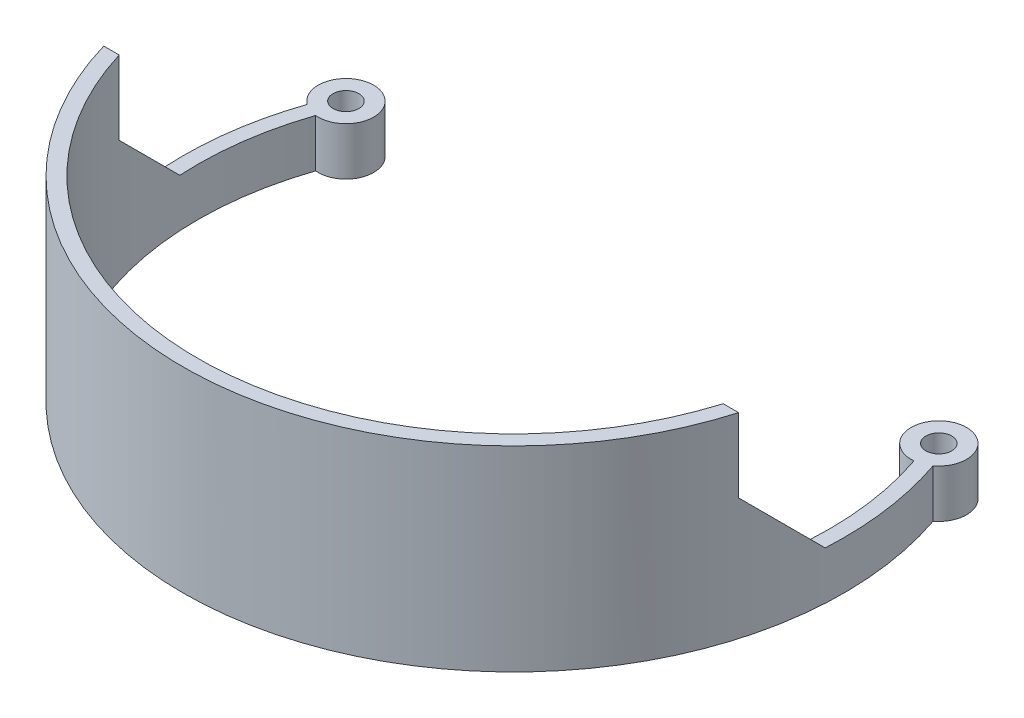
from build123d import *

# Parameters (mm, degrees)
SKETCH_1_R      = 2.2499999999999964
SKETCH_1_R_2    = 3.5000000000000075
EXTRUDE_3_DEPTH = 3
EXTRUDE_START   = 3
SKETCH_1_9_R    = 3.5000000000000075
EXTRUDE_4_DEPTH = 10
EXTRUDE_START_2 = 13
EXTRUDE_5_DEPTH = 40
CHAMFER_1_SIZE  = 20


with BuildPart() as part:
    # 草图1 → 凸台-拉伸3 (new body)
    # profile 1 of 5: a face of its own
    with BuildSketch(Plane(origin=(0, 0, 0), x_dir=(1, 0, 0), z_dir=(0, 1, 0))):
        with BuildLine():
            Line((81.76337811025178, -25), (85.93747727272425, -25))
            ThreePointArc((85.93747727272427, -25.00000000000003), (89.47720115518152, 2.0200181769446033), (84.72170874814934, 28.85276532316719))
            ThreePointArc((84.72170874814934, 28.852765323167215), (77.54750127881047, 41.87005748540227), (80.9872265222124, 27.41020138999083))
            ThreePointArc((80.98722652221241, 27.41020138999082), (85.49062597438983, 1.266045223118958), (81.76337811025176, -25.00000000000003))
        make_face()
        with BuildLine():
            ThreePointArc((79.50393531376338, 31.454320365013906), (78.90792202113376, 38.10634440334943), (83.19867820645547, 32.988330432119156))
            ThreePointArc((83.19867820645547, 32.988330432119156), (82.49378450242521, 32.18772445937683), (81.58047617746915, 31.636622870612896))
            ThreePointArc((81.58047617746915, 31.636622870612896), (80.55609271252037, 31.387290279852397), (79.50393531376338, 31.454320365013903))
        make_face(mode=Mode.SUBTRACT)
    # profile 2 of 5: a face of its own
    with BuildSketch(Plane(origin=(0, 0, 0), x_dir=(1, 0, 0), z_dir=(0, 1, 0))):
        with BuildLine():
            ThreePointArc((83.19867820645547, 32.988330432119156), (78.90792202113373, 38.10634440334942), (79.50393531376338, 31.454320365013903))
            ThreePointArc((79.50393531376338, 31.454320365013903), (80.55609271252037, 31.387290279852397), (81.58047617746915, 31.636622870612896))
            ThreePointArc((81.58047617746915, 31.636622870612896), (82.49378450242521, 32.18772445937683), (83.19867820645547, 32.988330432119156))
        make_face()
        with Locations(Location((80.25, 34.873879910328284, 0), (0, 0, 270))):
            Circle(SKETCH_1_R, mode=Mode.SUBTRACT)
    # profile 3 of 5: a face of its own
    with BuildSketch(Plane(origin=(0, 0, 0), x_dir=(1, 0, 0), z_dir=(0, 1, 0))):
        with BuildLine():
            ThreePointArc((-84.72170874814935, 28.85276532316715), (-89.4772011551815, 2.020018176944596), (-85.93747727272427, -25.00000000000001))
            Line((-85.93747727272425, -25), (-81.76337811025178, -25))
            ThreePointArc((-81.76337811025176, -25.000000000000007), (-85.49062597438983, 1.2660452231190007), (-80.98722652221241, 27.41020138999083))
            ThreePointArc((-80.98722652221241, 27.41020138999083), (-77.54750127881069, 41.87005748540241), (-84.72170874814934, 28.852765323167137))
        make_face()
        with Locations((-80.25, 34.873879910328284)):
            Circle(SKETCH_1_R_2, mode=Mode.SUBTRACT)
    # profile 4 of 5: a face of its own
    with BuildSketch(Plane(origin=(0, 0, 0), x_dir=(1, 0, 0), z_dir=(0, 1, 0))):
        with Locations((-80.25, 34.873879910328284)):
            Circle(SKETCH_1_R_2)
        with Locations(Location((-80.25, 34.873879910328284, 0), (0, 0, 270))):
            Circle(SKETCH_1_R, mode=Mode.SUBTRACT)
    # profile 5 of 5: a face of its own
    with BuildSketch(Plane(origin=(0, 0, 0), x_dir=(1, 0, 0), z_dir=(0, 1, 0))):
        with BuildLine():
            Line((-81.76337811025178, -25), (-85.93747727272425, -25))
            ThreePointArc((-85.93747727272427, -25.00000000000001), (3.55e-15, -89.5), (85.93747727272427, -25.00000000000003))
            Line((85.93747727272425, -25), (81.76337811025178, -25))
            ThreePointArc((81.76337811025176, -25.00000000000003), (-3.55e-15, -85.5), (-81.76337811025176, -25.000000000000007))
        make_face()
    extrude(amount=EXTRUDE_3_DEPTH)

    # 草图1<9> → 凸台-拉伸4 (add)
    # profile 1 of 3: a face of its own
    with BuildSketch(Plane(origin=(0, 0, 0), x_dir=(1, 0, 0), z_dir=(0, 1, 0)).offset(EXTRUDE_START)):
        with BuildLine():
            ThreePointArc((-84.72170874814935, 28.85276532316715), (-89.4772011551815, 2.020018176944596), (-85.93747727272427, -25.00000000000001))
            Line((-85.93747727272425, -25), (-81.76337811025178, -25))
            ThreePointArc((-81.76337811025176, -25.000000000000007), (-85.49062597438983, 1.2660452231190007), (-80.98722652221241, 27.41020138999083))
            ThreePointArc((-80.98722652221241, 27.41020138999083), (-77.54750127881069, 41.87005748540241), (-84.72170874814934, 28.852765323167137))
        make_face()
        with Locations(Location((-80.25, 34.873879910328284, 0), (0, 0, 270))):
            Circle(SKETCH_1_9_R, mode=Mode.SUBTRACT)
    # profile 2 of 3: a face of its own
    with BuildSketch(Plane(origin=(0, 0, 0), x_dir=(1, 0, 0), z_dir=(0, 1, 0)).offset(EXTRUDE_START)):
        with BuildLine():
            Line((-81.76337811025178, -25), (-85.93747727272425, -25))
            ThreePointArc((-85.93747727272427, -25.00000000000001), (3.55e-15, -89.5), (85.93747727272427, -25.00000000000003))
            Line((85.93747727272425, -25), (81.76337811025178, -25))
            ThreePointArc((81.76337811025176, -25.00000000000003), (-3.55e-15, -85.5), (-81.76337811025176, -25.000000000000007))
        make_face()
    # profile 3 of 3: a face of its own
    with BuildSketch(Plane(origin=(0, 0, 0), x_dir=(1, 0, 0), z_dir=(0, 1, 0)).offset(EXTRUDE_START)):
        with BuildLine():
            Line((81.76337811025178, -25), (85.93747727272425, -25))
            ThreePointArc((85.93747727272427, -25.00000000000003), (89.47720115518152, 2.0200181769446033), (84.72170874814934, 28.85276532316719))
            ThreePointArc((84.72170874814934, 28.852765323167215), (77.54750127881047, 41.87005748540227), (80.9872265222124, 27.41020138999083))
            ThreePointArc((80.98722652221241, 27.41020138999082), (85.49062597438983, 1.266045223118958), (81.76337811025176, -25.00000000000003))
        make_face()
        with BuildLine():
            ThreePointArc((79.50393531376338, 31.454320365013906), (78.90792202113376, 38.10634440334943), (83.19867820645547, 32.988330432119156))
            ThreePointArc((83.19867820645547, 32.988330432119156), (82.49378450242521, 32.18772445937683), (81.58047617746915, 31.636622870612896))
            ThreePointArc((81.58047617746915, 31.636622870612896), (80.55609271252037, 31.387290279852397), (79.50393531376338, 31.454320365013903))
        make_face(mode=Mode.SUBTRACT)
    extrude(amount=EXTRUDE_4_DEPTH)

    # 草图1<10> → 凸台-拉伸5 (add)
    with BuildSketch(Plane(origin=(0, 0, 0), x_dir=(1, 0, 0), z_dir=(0, 1, 0)).offset(EXTRUDE_START_2)):
        with BuildLine():
            Line((-81.76337811025178, -25), (-85.93747727272425, -25))
            ThreePointArc((-85.93747727272427, -25.00000000000001), (3.55e-15, -89.5), (85.93747727272427, -25.00000000000003))
            Line((85.93747727272425, -25), (81.76337811025178, -25))
            ThreePointArc((81.76337811025176, -25.00000000000003), (-3.55e-15, -85.5), (-81.76337811025176, -25.000000000000007))
        make_face()
    extrude(amount=EXTRUDE_5_DEPTH)

    # 倒角1
    chamfer_1_edges = [part.edges().sort_by_distance(p)[0] for p in [
        (-83.85042769148802, 13, 25),
        (83.85042769148802, 13, 25),
    ]]
    chamfer(chamfer_1_edges, length=CHAMFER_1_SIZE)


solid = part.part
